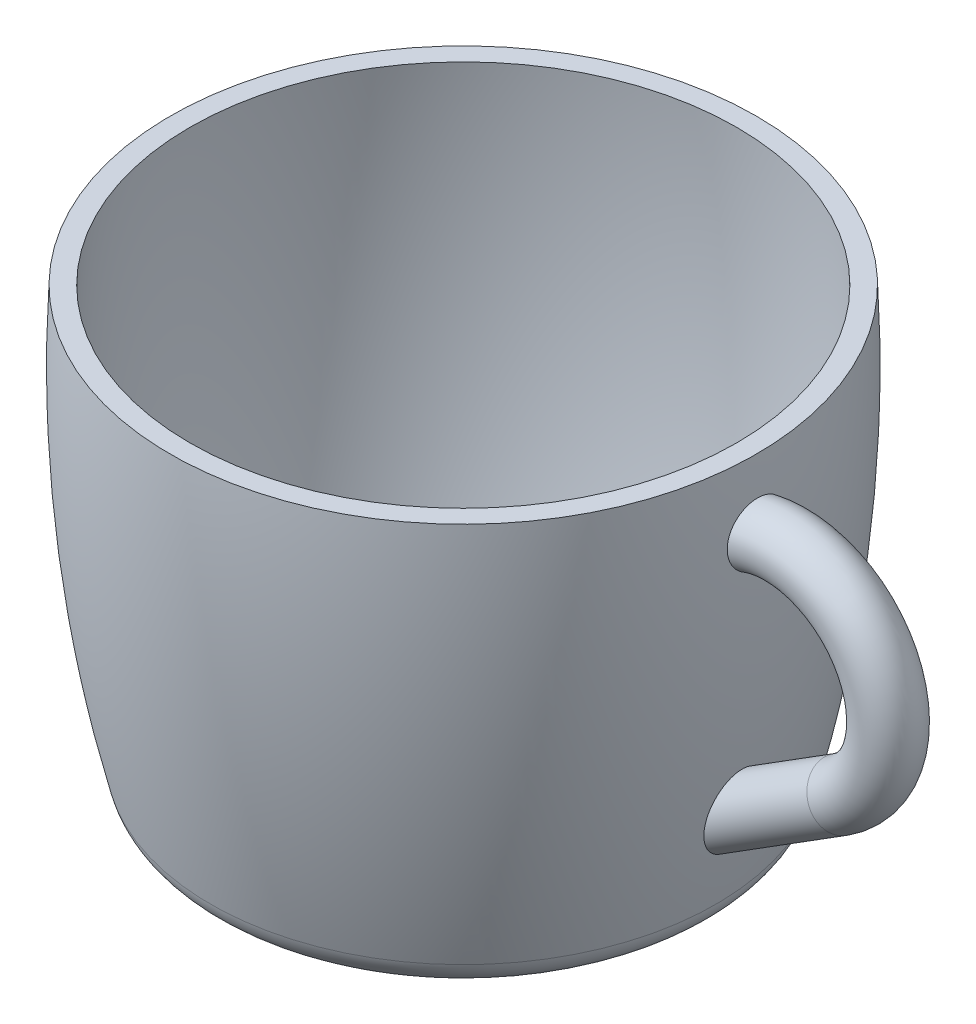
from build123d import *

# Parameters (mm, degrees)
SWEEP_3_PROFILE_R = 3


with BuildPart() as part:
    # 草图1 → 旋转4 (revolve)
    with BuildSketch(Plane.XY, mode=Mode.PRIVATE) as revolve_4_sk:
        with BuildLine():
            ThreePointArc((-25.879717235, 3.026452787), (-24.855827259, 1.199241055), (-23.048895616, 0.139971763))
            ThreePointArc((-23.048895616, 0.139971763), (-23.303233286, 1.069127889), (-23.551216897, 2))
            ThreePointArc((-23.551216897, 2), (-27.43205215, 23.328590557), (-27.997445995, 45))
            Line((-27.997445995, 45), (-30, 45))
            ThreePointArc((-30, 45), (-29.495782411, 23.860491006), (-25.879717235, 3.026452787))
        make_face()
        with BuildLine():
            Line((-22, 0), (0, 0))
            Line((0, 0), (0, 2))
            Line((0, 2), (-23.551216897, 2))
            ThreePointArc((-23.551216897, 2), (-23.303233286, 1.069127889), (-23.048895616, 0.139971763))
            ThreePointArc((-23.048895616, 0.139971763), (-22.529096897, 0.035147358), (-22, 0))
        make_face()
    revolve(revolve_4_sk.sketch.rotate(Axis((0, 0, 0), (0, 1, 0)), 270), axis=Axis((0, 0, 0), (0, 1, 0)))

    # 扫描3: sweep along a path in 草图2
    with BuildLine(Plane.XY) as sweep_3_path:
        Line((21.459141903, 8.351542668), (38.584893815, 19.108489381))
        ThreePointArc((38.584893815, 19.108489381), (41.891510619, 33.584893815), (27.415106185, 36.891510619))
    # 扫描3 profile (on start of the path) → 扫描3 (sweep)
    with BuildSketch(Plane(origin=(21.459141903, 8.351542668, 0), x_dir=(-0.5318946490098594, 0.8468105350990142, 0), z_dir=(0.8468105350990142, 0.5318946490098594, 0))):
        Circle(SWEEP_3_PROFILE_R)
    sweep(path=sweep_3_path.line)


solid = part.part
